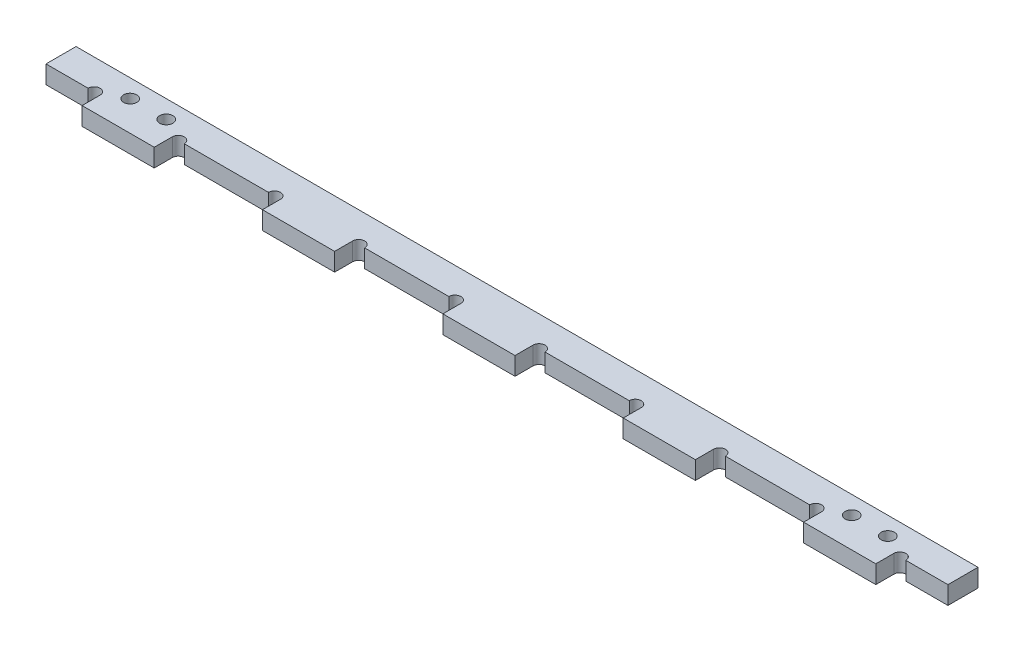
from build123d import *

# Parameters (mm, degrees)
SKETCH_1_W          = 150
SKETCH_1_H          = 5
EXTRUDE_1_DEPTH     = 1.5
SKETCH_2_W          = 12
SKETCH_2_H          = 3
EXTRUDE_2_DEPTH     = 3
SKETCH_3_R          = 1
CUT_EXTRUDE_1_DEPTH = 76.261211789
SKETCH_4_R          = 1.1
CUT_EXTRUDE_2_DEPTH = 76.261211789


with BuildPart() as part:
    # 草图1 → 凸台-拉伸1 (new, symmetric)
    with BuildSketch(Plane(origin=(0, 0, 0), x_dir=(1, 0, 0), z_dir=(0, 1, 0))):
        Rectangle(SKETCH_1_W, SKETCH_1_H)
    extrude(amount=EXTRUDE_1_DEPTH, both=True)

    # 草图2 → 凸台-拉伸2 (add)
    with BuildSketch(Plane(origin=(0, 1.5, 0), x_dir=(1, 0, 0), z_dir=(0, 1, 0))):
        with Locations((-60, -4)):
            Rectangle(SKETCH_2_W, SKETCH_2_H)
        with Locations((-30, -4)):
            Rectangle(SKETCH_2_W, SKETCH_2_H)
        with Locations((0, -4)):
            Rectangle(SKETCH_2_W, SKETCH_2_H)
        with Locations((30, -4)):
            Rectangle(SKETCH_2_W, SKETCH_2_H)
        with Locations((60, -4)):
            Rectangle(SKETCH_2_W, SKETCH_2_H)
    extrude(amount=-EXTRUDE_2_DEPTH)

    # 草图3 → 切除-拉伸1 (cut, through all)
    with BuildSketch(Plane.XZ.offset(1.5)):
        with Locations((67, 2.5)):
            Circle(SKETCH_3_R)
        with Locations((53, 2.5)):
            Circle(SKETCH_3_R)
        with Locations((37, 2.5)):
            Circle(SKETCH_3_R)
        with Locations((23, 2.5)):
            Circle(SKETCH_3_R)
        with Locations((7, 2.5)):
            Circle(SKETCH_3_R)
        with Locations((-7, 2.5)):
            Circle(SKETCH_3_R)
        with Locations((-23, 2.5)):
            Circle(SKETCH_3_R)
        with Locations((-37, 2.5)):
            Circle(SKETCH_3_R)
        with Locations((-53, 2.5)):
            Circle(SKETCH_3_R)
        with Locations((-67, 2.5)):
            Circle(SKETCH_3_R)
    extrude(amount=-CUT_EXTRUDE_1_DEPTH, mode=Mode.SUBTRACT)

    # 草图4 → 切除-拉伸2 (cut, through all)
    with BuildSketch(Plane(origin=(0, 1.5, 0), x_dir=(1, 0, 0), z_dir=(0, 1, 0))):
        with Locations(Location((63, -0.5, 0), (0, 0, 270))):
            Circle(SKETCH_4_R)
        with Locations(Location((57, -0.5, 0), (0, 0, 90))):
            Circle(SKETCH_4_R)
        with Locations(Location((-57, -0.5, 0), (0, 0, 270))):
            Circle(SKETCH_4_R)
        with Locations(Location((-63, -0.5, 0), (0, 0, 90))):
            Circle(SKETCH_4_R)
    extrude(amount=-CUT_EXTRUDE_2_DEPTH, mode=Mode.SUBTRACT)


solid = part.part
